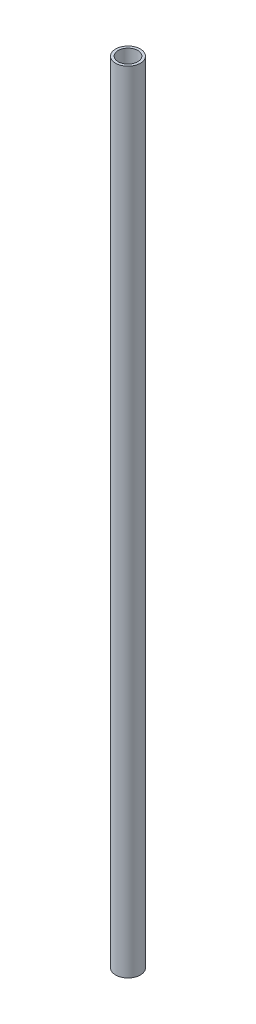
from build123d import *

# Parameters (mm, degrees)
SKETCH1_R           = 7.9375
SKETCH1_R_2         = 6.2865
BOSS_EXTRUDE1_DEPTH = 507


with BuildPart() as part:
    # Sketch1 → Boss-Extrude1 (new body)
    with BuildSketch(Plane(origin=(0, 0, 0), x_dir=(1, 0, 0), z_dir=(0, 1, 0))):
        with Locations(Location((0, 0, 0), (0, 0, 270))):
            Circle(SKETCH1_R)
        with Locations(Location((0, 0, 0), (0, 0, 270))):
            Circle(SKETCH1_R_2, mode=Mode.SUBTRACT)
    extrude(amount=BOSS_EXTRUDE1_DEPTH)


solid = part.part
